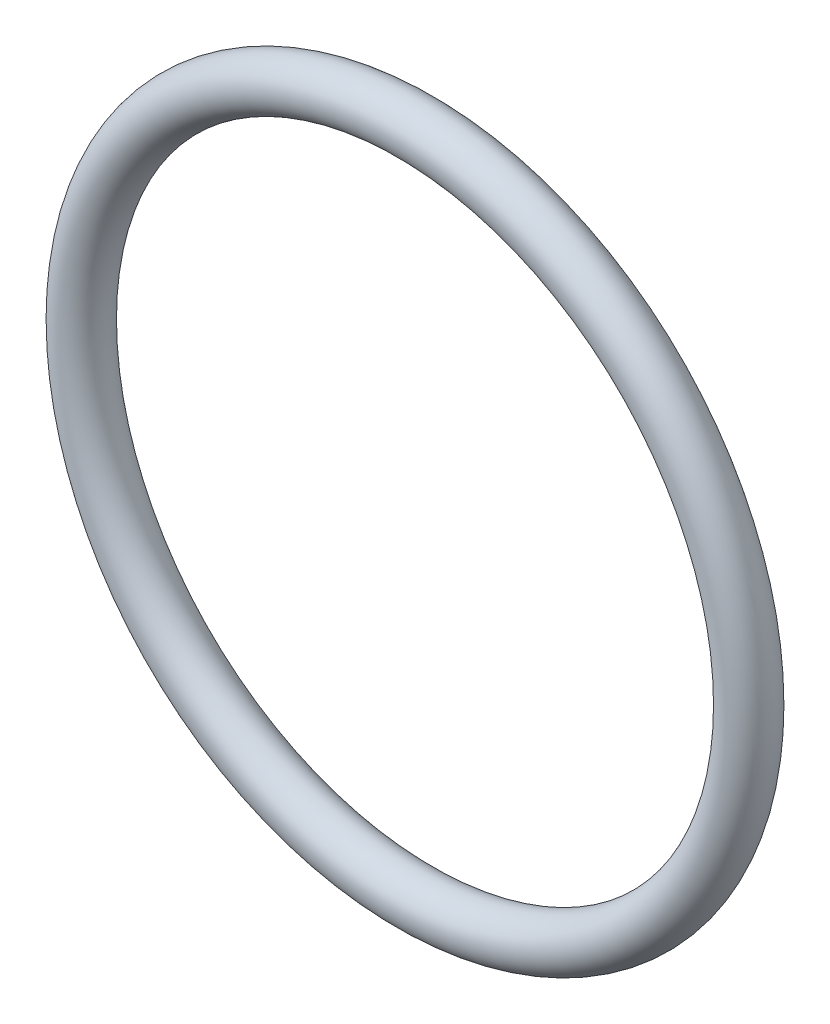
from build123d import *

# Parameters (mm, degrees)
SKETCH1_R = 1.27


with BuildPart() as part:
    # Sketch1 → Revolve1 (revolve)
    with BuildSketch(Plane(origin=(0, 0, 0), x_dir=(1, 0, 0), z_dir=(0, 1, 0)), mode=Mode.PRIVATE) as revolve1_sk:
        with Locations((17.018, 0)):
            Circle(SKETCH1_R)
    revolve(revolve1_sk.sketch.rotate(Axis((0, 0, -37.521712425), (0, 0, 1)), 180), axis=Axis((0, 0, -37.521712425), (0, 0, 1)))


solid = part.part
